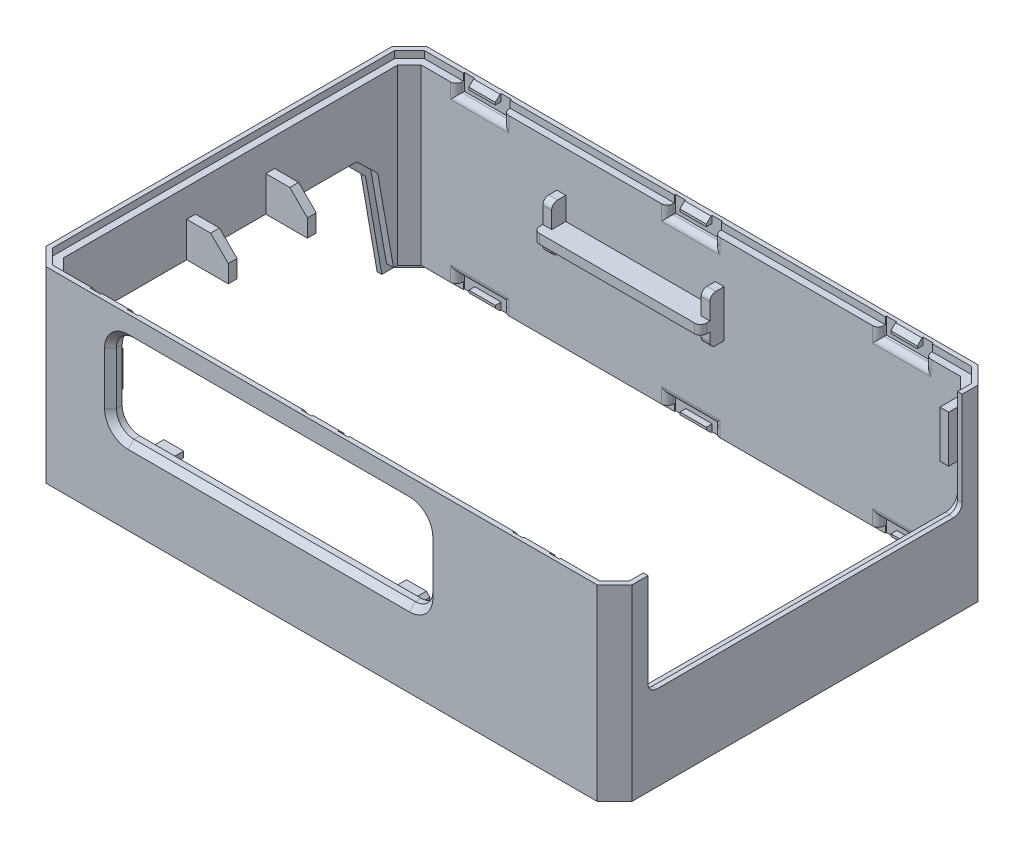
from build123d import *

# Parameters (mm, degrees)
SKETCH_1_W                   = 100
SKETCH_1_H                   = 65
EXTRUDE_1_DEPTH              = 32
SKETCH_2_W                   = 96
SKETCH_2_H                   = 61
CUT_EXTRUDE_1_DEPTH          = 68.677544282
CUT_EXTRUDE_2_DEPTH          = 2
SKETCH_7_W                   = 54
SKETCH_7_H                   = 15
CUT_EXTRUDE_3_DEPTH          = 2.5
FILLET_7_R                   = 3
CHAMFER_1_SIZE               = 1
SKETCH_17_W                  = 1.5
SKETCH_17_H                  = 6
EXTRUDE_6_DEPTH              = 7.1
CHAMFER_6_SIZE               = 3
CHAMFER_7_SIZE               = 2
CHAMFER_8_SIZE               = 3
EXTRUDE_13_DEPTH             = 0.8
SKETCH_35_W                  = 56
SKETCH_35_H                  = 18
CUT_EXTRUDE_6_DEPTH          = 1.2
FILLET_17_R                  = 2
CUT_EXTRUDE_7_DEPTH          = 1.2
SKETCH_44_W                  = 1.5
SKETCH_44_H                  = 8
EXTRUDE_15_DEPTH             = 1.5
EXTRUDE_15_DIRECTION_2_REACH = 86.76
EXTRUDE_START                = -2
SKETCH_45_W                  = 1.5
SKETCH_45_H                  = 8
EXTRUDE_16_DEPTH             = 3.5
CUT_EXTRUDE_8_DEPTH          = 1.2
SKETCH_57_W                  = 1.5
SKETCH_57_H                  = 6
SKETCH_57_W_2                = 4
SKETCH_57_H_2                = 1
EXTRUDE_27_DEPTH             = 2.5
SKETCH_60_W                  = 1.25
SKETCH_60_H                  = 6
EXTRUDE_28_DEPTH             = 1
SKETCH_61_W                  = 1.25
SKETCH_61_H                  = 6
EXTRUDE_29_DEPTH             = 1
CHAMFER_16_SIZE              = 0.6
CUT_EXTRUDE_9_DEPTH          = 1.2
SKETCH_63_W                  = 28.5
SKETCH_63_H                  = 1.6
EXTRUDE_30_DEPTH             = 4
SKETCH_64_W                  = 1.5
SKETCH_64_H                  = 8
EXTRUDE_31_DEPTH             = 2.4
FILLET_18_R                  = 1
SKETCH_65_W                  = 8
SKETCH_65_H                  = 2.8
CUT_EXTRUDE_10_DEPTH         = 1.4
SKETCH_67_W                  = 8
SKETCH_67_H                  = 2.8
CUT_EXTRUDE_11_DEPTH         = 1.4
FILLET_19_R                  = 1
SKETCH_70_W                  = 4.5
SKETCH_70_H                  = 1.2
EXTRUDE_32_DEPTH             = 1
SKETCH_71_W                  = 4.5
SKETCH_71_H                  = 1.2
EXTRUDE_33_DEPTH             = 1
CHAMFER_17_SIZE              = 0.8


with BuildPart() as part:
    # 草图1 → 凸台-拉伸1 (new body)
    with BuildSketch(Plane(origin=(0, 0, 0), x_dir=(1, 0, 0), z_dir=(0, 1, 0))):
        Rectangle(SKETCH_1_W, SKETCH_1_H)
    extrude(amount=EXTRUDE_1_DEPTH)

    # 草图2 → 切除-拉伸1 (cut, through all)
    with BuildSketch(Plane(origin=(0, 32, 0), x_dir=(1, 0, 0), z_dir=(0, 1, 0))):
        Rectangle(SKETCH_2_W, SKETCH_2_H)
    extrude(amount=-CUT_EXTRUDE_1_DEPTH, mode=Mode.SUBTRACT)

    # 草图4 → 切除-拉伸2 (cut)
    with BuildSketch(Plane.ZY.offset(50)):
        Polygon((-28, 0), (28, 0), (25.09, 16.5), (21.5, 20), (-21.5, 20), (-25.086271229, 16.5), align=None)
    extrude(amount=-CUT_EXTRUDE_2_DEPTH, mode=Mode.SUBTRACT)

    # 草图7 → 切除-拉伸3 (cut)
    with BuildSketch(Plane.XY.offset(32.5)):
        with Locations((-9, 20.5)):
            Rectangle(SKETCH_7_W, SKETCH_7_H)
    extrude(amount=-CUT_EXTRUDE_3_DEPTH, mode=Mode.SUBTRACT)

    # 圆角7
    fillet_7_edges = [part.edges().sort_by_distance(p)[0] for p in [
        (-36, 28, 31.5),
        (18, 28, 31.5),
        (18, 13, 31.5),
        (-36, 13, 31.5),
    ]]
    fillet(fillet_7_edges, radius=FILLET_7_R)

    # 倒角1
    chamfer_1_edges = [part.edges().sort_by_distance(p)[0] for p in [
        (-36, 20.5, 32.5),
        (-9, 28, 32.5),
        (18, 20.5, 32.5),
        (-9, 13, 32.5),
        (-35.121320344, 27.121320344, 32.5),
        (17.121320344, 27.121320344, 32.5),
        (17.121320344, 13.878679656, 32.5),
        (-35.121320344, 13.878679656, 32.5),
    ]]
    chamfer(chamfer_1_edges, length=CHAMFER_1_SIZE)

    # 草图17 → 凸台-拉伸6 (add)
    with BuildSketch(Plane(origin=(-48, 0, 0), x_dir=(0, 0, -1), z_dir=(1, 0, 0))):
        with Locations((-6.75, 23)):
            Rectangle(SKETCH_17_W, SKETCH_17_H)
        with Locations((6.75, 23)):
            Rectangle(SKETCH_17_W, SKETCH_17_H)
    extrude(amount=EXTRUDE_6_DEPTH)

    # 倒角6
    chamfer_6_edges = [part.edges().sort_by_distance(p)[0] for p in [
        (-40.9, 26, 6.75),
        (-40.9, 26, -6.75),
    ]]
    chamfer(chamfer_6_edges, length=CHAMFER_6_SIZE)

    # 倒角7
    chamfer_7_edges = [part.edges().sort_by_distance(p)[0] for p in [
        (48, 16, 30.5),
        (-48, 16, 30.5),
        (-48, 16, -30.5),
        (48, 16, -30.5),
    ]]
    chamfer(chamfer_7_edges, length=CHAMFER_7_SIZE)

    # 倒角8
    chamfer_8_edges = [part.edges().sort_by_distance(p)[0] for p in [
        (50, 16, 32.5),
        (-50, 16, 32.5),
        (-50, 16, -32.5),
        (50, 16, -32.5),
    ]]
    chamfer(chamfer_8_edges, length=CHAMFER_8_SIZE)

    # 草图28 → 凸台-拉伸13 (add)
    with BuildSketch(Plane.ZY.offset(50)):
        Polygon((-29.3, 22.339257284), (-29.3, 0), (-26.987219274, 0), (-24.215415004, 15.878420983), (-21.117618719, 18.989598736), (21.117598959, 18.989598736), (24.215163854, 15.878391236), (27.007954871, 0), (29.3, 0), (29.3, 22.339257284), align=None)
    extrude(amount=-EXTRUDE_13_DEPTH)

    # 草图35 → 切除-拉伸6 (cut)
    with BuildSketch(Plane.ZY.offset(-48)):
        with Locations((0, 23)):
            Rectangle(SKETCH_35_W, SKETCH_35_H)
    extrude(amount=-CUT_EXTRUDE_6_DEPTH, mode=Mode.SUBTRACT)

    # 圆角17
    fillet_17_edges = [part.edges().sort_by_distance(p)[0] for p in [
        (48.6, 14, -28),
        (48.6, 14, 28),
    ]]
    fillet(fillet_17_edges, radius=FILLET_17_R)

    # 草图39 → 切除-拉伸7 (cut)
    with BuildSketch(Plane.ZY.offset(-49.2)):
        with BuildLine():
            Line((-26.8, 32), (-26.8, 16))
            ThreePointArc((-26.8, 16), (-26.360660172, 14.939339828), (-25.3, 14.5))
            Line((-25.3, 14.5), (25.3, 14.5))
            ThreePointArc((25.3, 14.5), (26.360660172, 14.939339828), (26.8, 16))
            Line((26.8, 16), (26.8, 32))
            Line((26.8, 32), (-26.8, 32))
        make_face()
    extrude(amount=-CUT_EXTRUDE_7_DEPTH, mode=Mode.SUBTRACT)

    # 草图44 → 凸台-拉伸15 (add)
    with BuildSketch(Plane.XY.offset(-28)):
        with Locations((47.25, 24.5)):
            Rectangle(SKETCH_44_W, SKETCH_44_H)
    extrude(amount=EXTRUDE_15_DEPTH)

    # 凸台-拉伸15 direction 2: up to this face of the body (flat: up to its plane)
    extrude_15_direction_2_end = Plane(part.part.faces().sort_by_distance((0, 16, -30.5))[0])
    # 草图44 → 凸台-拉伸15 direction 2 (add, up to the picked face)
    with BuildSketch(Plane.XY.offset(-28), mode=Mode.PRIVATE) as extrude_15_direction_2_sk1:
        with Locations((47.25, 24.5)):
            Rectangle(SKETCH_44_W, SKETCH_44_H)
    extrude_15_direction_2_tool1 = split(extrude(extrude_15_direction_2_sk1.sketch, amount=-EXTRUDE_15_DIRECTION_2_REACH, mode=Mode.PRIVATE), bisect_by=extrude_15_direction_2_end, keep=Keep.BOTH, mode=Mode.PRIVATE)
    add(extrude_15_direction_2_tool1.solids().sort_by(Axis((47.25, 24.5, -28), (0, 0, -1)))[0])

    # 草图45 → 凸台-拉伸16 (add)
    with BuildSketch(Plane(origin=(0, 0, 28), x_dir=(-1, 0, 0), z_dir=(0, 0, -1)).offset(EXTRUDE_START)):
        with Locations((-47.25, 24.5)):
            Rectangle(SKETCH_45_W, SKETCH_45_H)
    extrude(amount=EXTRUDE_16_DEPTH)

    # 草图48 → 切除-拉伸8 (cut)
    with BuildSketch(Plane(origin=(0, 32, 0), x_dir=(1, 0, 0), z_dir=(0, 1, 0))):
        Polygon((49.2, 29.16862915), (49.2, -29.16862915), (46.66862915, -31.7), (-46.66862915, -31.7), (-49.2, -29.16862915), (-49.2, 29.16862915), (-46.66862915, 31.7), (46.66862915, 31.7), align=None)
    extrude(amount=-CUT_EXTRUDE_8_DEPTH, mode=Mode.SUBTRACT)

    # 草图57 → 凸台-拉伸27 (add)
    with BuildSketch(Plane(origin=(0, 0, 30.5), x_dir=(-1, 0, 0), z_dir=(0, 0, -1))):
        with Locations((-21.95, 19)):
            Rectangle(SKETCH_57_W, SKETCH_57_H)
        with Locations((40.15, 19)):
            Rectangle(SKETCH_57_W, SKETCH_57_H)
        with Locations((-12, 11.5)):
            Rectangle(SKETCH_57_W_2, SKETCH_57_H_2)
        with Locations((30, 11.5)):
            Rectangle(SKETCH_57_W_2, SKETCH_57_H_2)
    extrude(amount=EXTRUDE_27_DEPTH)

    # 草图60 → 凸台-拉伸28 (add)
    with BuildSketch(Plane.ZY.offset(-21.2)):
        with Locations((28.625, 19)):
            Rectangle(SKETCH_60_W, SKETCH_60_H)
    extrude(amount=EXTRUDE_28_DEPTH)

    # 草图61 → 凸台-拉伸29 (add)
    with BuildSketch(Plane(origin=(-39.4, 0, 0), x_dir=(0, 0, -1), z_dir=(1, 0, 0))):
        with Locations((-28.625, 19)):
            Rectangle(SKETCH_61_W, SKETCH_61_H)
    extrude(amount=EXTRUDE_29_DEPTH)

    # 倒角16
    chamfer_16_edges = [part.edges().sort_by_distance(p)[0] for p in [
        (14, 12, 29.25),
        (-32, 12, 29.25),
    ]]
    chamfer(chamfer_16_edges, length=CHAMFER_16_SIZE)

    # 草图62 → 切除-拉伸9 (cut)
    with BuildSketch(Plane.XZ):
        Polygon((-49.2, 28.997056275), (-49.2, -28.997056275), (-46.497056275, -31.7), (46.497056275, -31.7), (49.2, -28.997056275), (49.2, 28.997056275), (46.497056275, 31.7), (-46.497056275, 31.7), align=None)
    extrude(amount=-CUT_EXTRUDE_9_DEPTH, mode=Mode.SUBTRACT)

    # 草图63 → 凸台-拉伸30 (add)
    with BuildSketch(Plane.XY.offset(-30.5)):
        with Locations((-8.57786607, 19.2)):
            Rectangle(SKETCH_63_W, SKETCH_63_H)
    extrude(amount=EXTRUDE_30_DEPTH)

    # 草图64 → 凸台-拉伸31 (add)
    with BuildSketch(Plane.XY.offset(-30.5)):
        with Locations((-22.07786607, 19.88318929)):
            Rectangle(SKETCH_64_W, SKETCH_64_H)
        with Locations((4.92213393, 19.88318929)):
            Rectangle(SKETCH_64_W, SKETCH_64_H)
    extrude(amount=EXTRUDE_31_DEPTH)

    # 圆角18
    fillet_18_edges = [part.edges().sort_by_distance(p)[0] for p in [
        (-22.82786607, 19.2, -26.5),
        (5.67213393, 19.2, -26.5),
        (-22.07786607, 15.88318929, -28.1),
        (-22.07786607, 23.88318929, -28.1),
        (4.92213393, 15.88318929, -28.1),
        (4.92213393, 23.88318929, -28.1),
    ]]
    fillet(fillet_18_edges, radius=FILLET_18_R)

    # 草图65 → 切除-拉伸10 (cut)
    with BuildSketch(Plane.XY.offset(-30.5)):
        with Locations((36, 30.6)):
            Rectangle(SKETCH_65_W, SKETCH_65_H)
        with Locations((0, 30.6)):
            Rectangle(SKETCH_65_W, SKETCH_65_H)
        with Locations((-36, 30.6)):
            Rectangle(SKETCH_65_W, SKETCH_65_H)
        with Locations((-36, 1.4)):
            Rectangle(SKETCH_65_W, SKETCH_65_H)
        with Locations((0, 1.4)):
            Rectangle(SKETCH_65_W, SKETCH_65_H)
        with Locations((36, 1.4)):
            Rectangle(SKETCH_65_W, SKETCH_65_H)
    extrude(amount=-CUT_EXTRUDE_10_DEPTH, mode=Mode.SUBTRACT)

    # 草图67 → 切除-拉伸11 (cut)
    with BuildSketch(Plane(origin=(0, 0, 30.5), x_dir=(-1, 0, 0), z_dir=(0, 0, -1))):
        with Locations((0, 30.6)):
            Rectangle(SKETCH_67_W, SKETCH_67_H)
        with Locations((-36, 30.6)):
            Rectangle(SKETCH_67_W, SKETCH_67_H)
        with Locations((-36, 1.4)):
            Rectangle(SKETCH_67_W, SKETCH_67_H)
        with Locations((0, 1.4)):
            Rectangle(SKETCH_67_W, SKETCH_67_H)
        with Locations((36, 1.4)):
            Rectangle(SKETCH_67_W, SKETCH_67_H)
        with Locations((36, 30.6)):
            Rectangle(SKETCH_67_W, SKETCH_67_H)
    extrude(amount=-CUT_EXTRUDE_11_DEPTH, mode=Mode.SUBTRACT)

    # 圆角19
    fillet_19_edges = [part.edges().sort_by_distance(p)[0] for p in [
        (40, 2, -30.5),
        (36, 2.8, -30.5),
        (32, 2, -30.5),
        (-4, 30, -30.5),
        (0, 29.2, -30.5),
        (4, 30, -30.5),
        (-32, 2, -30.5),
        (-36, 2.8, -30.5),
        (-40, 2, -30.5),
        (-40, 30, -30.5),
        (-36, 29.2, -30.5),
        (-32, 30, -30.5),
        (4, 2, -30.5),
        (0, 2.8, -30.5),
        (-4, 2, -30.5),
        (32, 30, -30.5),
        (36, 29.2, -30.5),
        (40, 30, -30.5),
        (40, 30, 30.5),
        (36, 29.2, 30.5),
        (32, 30, 30.5),
        (40, 2, 30.5),
        (32, 2, 30.5),
        (36, 2.8, 30.5),
        (4, 2, 30.5),
        (-4, 2, 30.5),
        (0, 2.8, 30.5),
        (-32, 2, 30.5),
        (-40, 2, 30.5),
        (-36, 2.8, 30.5),
        (-32, 30, 30.5),
        (-36, 29.2, 30.5),
        (-40, 30, 30.5),
        (4, 30, 30.5),
        (0, 29.2, 30.5),
        (-4, 30, 30.5),
    ]]
    fillet(fillet_19_edges, radius=FILLET_19_R)

    # 草图70 → 凸台-拉伸32 (add)
    with BuildSketch(Plane.XY.offset(-31.9)):
        with Locations((-36, 31.4)):
            Rectangle(SKETCH_70_W, SKETCH_70_H)
        with Locations((0, 31.4)):
            Rectangle(SKETCH_70_W, SKETCH_70_H)
        with Locations((36, 31.4)):
            Rectangle(SKETCH_70_W, SKETCH_70_H)
        with Locations((36, 0.6)):
            Rectangle(SKETCH_70_W, SKETCH_70_H)
        with Locations((0, 0.6)):
            Rectangle(SKETCH_70_W, SKETCH_70_H)
        with Locations((-36, 0.6)):
            Rectangle(SKETCH_70_W, SKETCH_70_H)
    extrude(amount=EXTRUDE_32_DEPTH)

    # 草图71 → 凸台-拉伸33 (add)
    with BuildSketch(Plane(origin=(0, 0, 31.9), x_dir=(-1, 0, 0), z_dir=(0, 0, -1))):
        with Locations((-36, 0.6)):
            Rectangle(SKETCH_71_W, SKETCH_71_H)
        with Locations((0, 0.6)):
            Rectangle(SKETCH_71_W, SKETCH_71_H)
        with Locations((36, 0.6)):
            Rectangle(SKETCH_71_W, SKETCH_71_H)
        with Locations((36, 31.4)):
            Rectangle(SKETCH_71_W, SKETCH_71_H)
        with Locations((0, 31.4)):
            Rectangle(SKETCH_71_W, SKETCH_71_H)
        with Locations((-36, 31.4)):
            Rectangle(SKETCH_71_W, SKETCH_71_H)
    extrude(amount=EXTRUDE_33_DEPTH)

    # 倒角17
    chamfer_17_edges = [part.edges().sort_by_distance(p)[0] for p in [
        (-36, 32, -30.9),
        (0, 32, -30.9),
        (36, 32, -30.9),
        (0, 0, -30.9),
        (-36, 0, -30.9),
        (36, 0, -30.9),
        (36, 0, 30.9),
        (0, 0, 30.9),
        (-36, 0, 30.9),
        (-36, 32, 30.9),
        (0, 32, 30.9),
        (36, 32, 30.9),
    ]]
    chamfer(chamfer_17_edges, length=CHAMFER_17_SIZE)


solid = part.part
